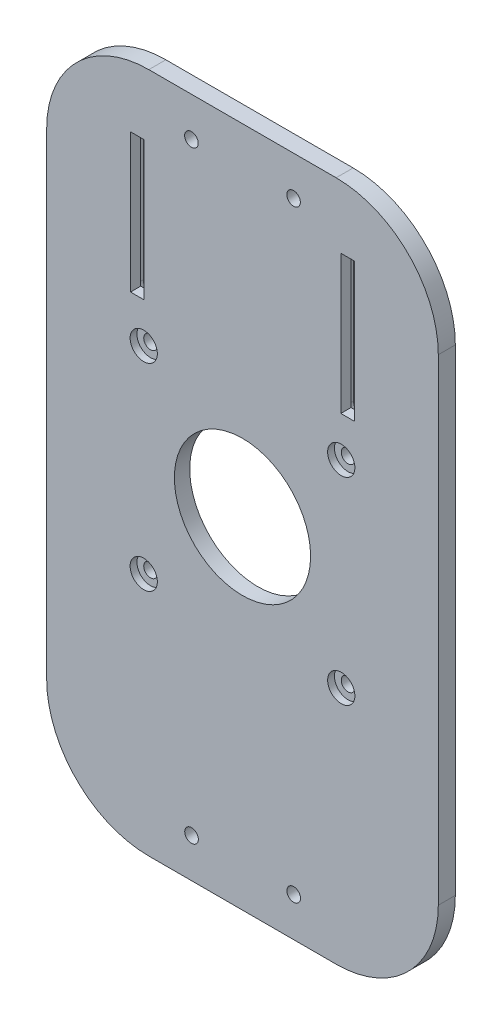
from build123d import *

# Parameters (mm, degrees)
SKETCH1_W           = 200
SKETCH1_H           = 115
SKETCH1_R           = 20
BOSS_EXTRUDE1_DEPTH = 5
CUT_EXTRUDE1_REACH  = 117.461
SKETCH4_R           = 2
SKETCH5_R           = 4
CUT_EXTRUDE2_DEPTH  = 2
FILLET1_R           = 30
SKETCH8_R           = 2
CUT_EXTRUDE4_DEPTH  = 116.461032388
SKETCH11_W          = 71.5
SKETCH11_H          = 71.5
CUT_EXTRUDE7_DEPTH  = 0.5
SKETCH9_W           = 4
SKETCH9_H           = 40.75
CUT_EXTRUDE5_DEPTH  = 116.461032388
CUT_EXTRUDE8_DEPTH  = 2


with BuildPart() as part:
    # Sketch1 → Boss-Extrude1 (new body)
    with BuildSketch(Plane(origin=(0, 0, 0), x_dir=(0, 1, 0), z_dir=(0, 0, 1))):
        Rectangle(SKETCH1_W, SKETCH1_H)
        with Locations(Location((0, 0, 0), (0, 0, 270))):
            Circle(SKETCH1_R, mode=Mode.SUBTRACT)
    extrude(amount=BOSS_EXTRUDE1_DEPTH)

    # Sketch4 → Cut-Extrude1 (cut, up to next)
    with BuildSketch(Plane.XY.offset(5), mode=Mode.PRIVATE) as cut_extrude1_sk1:
        with Locations((29, 29)):
            Circle(SKETCH4_R)
    cut_extrude1_tool1 = extrude(cut_extrude1_sk1.sketch, amount=-CUT_EXTRUDE1_REACH, mode=Mode.PRIVATE) & part.part
    # Sketch4 → Cut-Extrude1 (cut, up to next)
    with BuildSketch(Plane.XY.offset(5), mode=Mode.PRIVATE) as cut_extrude1_sk2:
        with Locations((-29, 29)):
            Circle(SKETCH4_R)
    cut_extrude1_tool2 = extrude(cut_extrude1_sk2.sketch, amount=-CUT_EXTRUDE1_REACH, mode=Mode.PRIVATE) & part.part
    # Sketch4 → Cut-Extrude1 (cut, up to next)
    with BuildSketch(Plane.XY.offset(5), mode=Mode.PRIVATE) as cut_extrude1_sk3:
        with Locations((-29, -29)):
            Circle(SKETCH4_R)
    cut_extrude1_tool3 = extrude(cut_extrude1_sk3.sketch, amount=-CUT_EXTRUDE1_REACH, mode=Mode.PRIVATE) & part.part
    # Sketch4 → Cut-Extrude1 (cut, up to next)
    with BuildSketch(Plane.XY.offset(5), mode=Mode.PRIVATE) as cut_extrude1_sk4:
        with Locations((29, -29)):
            Circle(SKETCH4_R)
    cut_extrude1_tool4 = extrude(cut_extrude1_sk4.sketch, amount=-CUT_EXTRUDE1_REACH, mode=Mode.PRIVATE) & part.part
    add(cut_extrude1_tool1.solids().sort_by_distance((29, 29, 5))[0], mode=Mode.SUBTRACT)
    add(cut_extrude1_tool2.solids().sort_by_distance((-29, 29, 5))[0], mode=Mode.SUBTRACT)
    add(cut_extrude1_tool3.solids().sort_by_distance((-29, -29, 5))[0], mode=Mode.SUBTRACT)
    add(cut_extrude1_tool4.solids().sort_by_distance((29, -29, 5))[0], mode=Mode.SUBTRACT)

    # Sketch5 → Cut-Extrude2 (cut)
    with BuildSketch(Plane.XY.offset(5)):
        with Locations((-29, -29)):
            Circle(SKETCH5_R)
        with Locations((-29, 29)):
            Circle(SKETCH5_R)
        with Locations((29, -29)):
            Circle(SKETCH5_R)
        with Locations((29, 29)):
            Circle(SKETCH5_R)
    extrude(amount=-CUT_EXTRUDE2_DEPTH, mode=Mode.SUBTRACT)

    # Fillet1
    fillet1_edges = [part.edges().sort_by_distance(p)[0] for p in [
        (57.5, 100, 2.5),
        (57.5, -100, 2.5),
        (-57.5, -100, 2.5),
        (-57.5, 100, 2.5),
    ]]
    fillet(fillet1_edges, radius=FILLET1_R)

    # Sketch8 → Cut-Extrude4 (cut, through all)
    with BuildSketch(Plane.XY.offset(5)):
        with Locations((15, 88.5)):
            Circle(SKETCH8_R)
        with Locations((-15, 88.5)):
            Circle(SKETCH8_R)
        with Locations((-14.960853972, -88.5)):
            Circle(SKETCH8_R)
        with Locations((15.039146028, -88.5)):
            Circle(SKETCH8_R)
    extrude(amount=-CUT_EXTRUDE4_DEPTH, mode=Mode.SUBTRACT)

    # Sketch11 → Cut-Extrude7 (cut)
    with BuildSketch(Plane(origin=(0, 0, 0), x_dir=(1, 0, 0), z_dir=(0, 0, -1))):
        Rectangle(SKETCH11_W, SKETCH11_H)
    extrude(amount=-CUT_EXTRUDE7_DEPTH, mode=Mode.SUBTRACT)

    # Sketch9 → Cut-Extrude5 (cut, through all)
    with BuildSketch(Plane.XY.offset(5)):
        with Locations((30.875, 61.125)):
            Rectangle(SKETCH9_W, SKETCH9_H)
        with Locations((-30.875, 61.125)):
            Rectangle(SKETCH9_W, SKETCH9_H)
    extrude(amount=-CUT_EXTRUDE5_DEPTH, mode=Mode.SUBTRACT)

    # Sketch12 → Cut-Extrude8 (cut)
    with BuildSketch(Plane(origin=(0, 0, 0), x_dir=(1, 0, 0), z_dir=(0, 0, -1))):
        with BuildLine():
            Line((-34.125, -81.5), (-34.125, -40.75))
            ThreePointArc((-34.125, -40.75), (-30.875, -37.5), (-27.625, -40.75))
            Line((-27.625, -40.75), (-27.625, -81.5))
            ThreePointArc((-27.625, -81.5), (-30.875, -84.75), (-34.125, -81.5))
        make_face()
        with BuildLine():
            Line((34.125, -81.5), (34.125, -40.75))
            ThreePointArc((34.125, -40.75), (30.875, -37.5), (27.625, -40.75))
            Line((27.625, -40.75), (27.625, -81.5))
            ThreePointArc((27.625, -81.5), (30.875, -84.75), (34.125, -81.5))
        make_face()
    extrude(amount=-CUT_EXTRUDE8_DEPTH, mode=Mode.SUBTRACT)


solid = part.part
